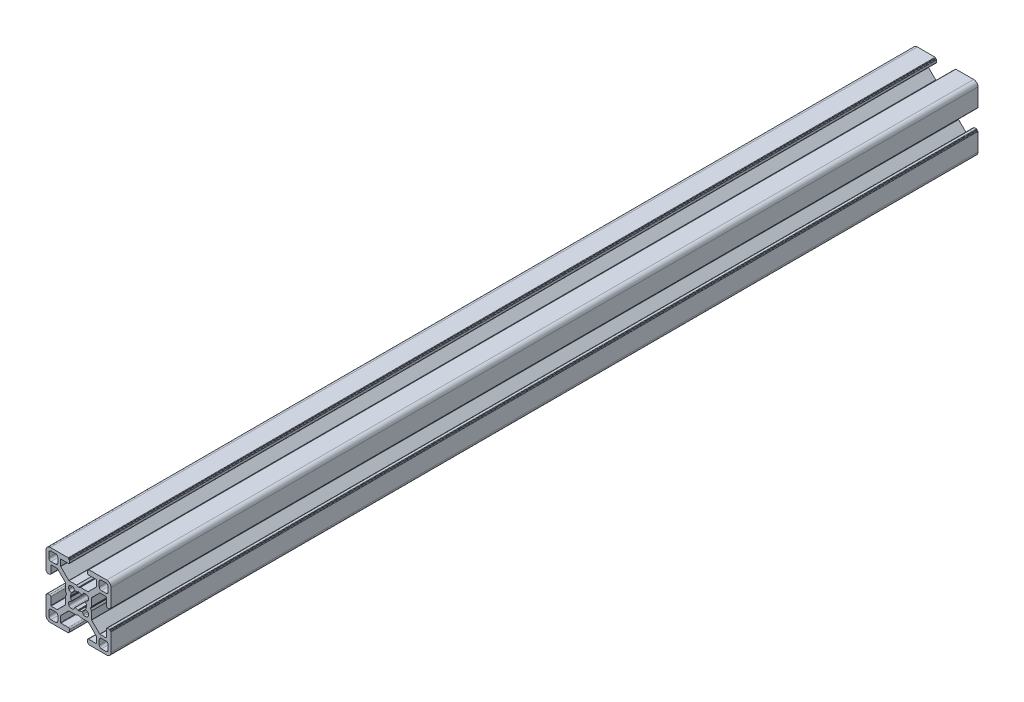
from build123d import *

# Parameters (mm, degrees)
BOSS_EXTRUDE1_DEPTH = 200


with BuildPart() as part:
    # Sketch1 → Boss-Extrude1 (new, symmetric)
    with BuildSketch(Plane.XY):
        with BuildLine():
            Line((15, -4.7974), (15, -12.9934))
            ThreePointArc((15, -12.9934), (14.412280467, -14.412280467), (12.9934, -15))
            Line((12.9934, -15), (4.7974, -15))
            ThreePointArc((4.7974, -15), (4.655978644, -14.941421356), (4.5974, -14.8))
            Line((4.5974, -14.8), (4.5974, -14.7018))
            ThreePointArc((4.5974, -14.7018), (4.538821356, -14.560378644), (4.3974, -14.5018))
            Line((4.3974, -14.5018), (4.2513, -14.5018))
            ThreePointArc((4.2513, -14.5018), (4.109878644, -14.443221356), (4.0513, -14.3018))
            Line((4.0513, -14.3018), (4.0513, -13.4096))
            ThreePointArc((4.0513, -13.4096), (4.229847706, -12.978547706), (4.6609, -12.8))
            Line((4.6609, -12.8), (8.055, -12.8))
            ThreePointArc((8.055, -12.8), (8.196421356, -12.741421356), (8.255, -12.6))
            Line((8.255, -12.6), (8.255, -9.893477631))
            ThreePointArc((8.255, -9.893477631), (8.239775906, -9.816940945), (8.196421356, -9.752056275))
            Line((8.196421356, -9.752056275), (4.510043725, -6.065678644))
            ThreePointArc((4.510043725, -6.065678644), (4.445159055, -6.022324094), (4.368622369, -6.0071))
            Line((4.368622369, -6.0071), (0.933471649, -6.0071))
            ThreePointArc((0.933471649, -6.0071), (0.88170784, -6.000285165), (0.833471649, -5.980305081))
            Line((0.833471649, -5.980305081), (0.1, -5.556835027))
            ThreePointArc((0.1, -5.556835027), (0, -5.530040108), (-0.1, -5.556835027))
            Line((-0.1, -5.556835027), (-0.833471649, -5.980305081))
            ThreePointArc((-0.833471649, -5.980305081), (-0.88170784, -6.000285165), (-0.933471649, -6.0071))
            Line((-0.933471649, -6.0071), (-4.368622369, -6.0071))
            ThreePointArc((-4.368622369, -6.0071), (-4.445159055, -6.022324094), (-4.510043725, -6.065678644))
            Line((-4.510043725, -6.065678644), (-8.196421356, -9.752056275))
            ThreePointArc((-8.196421356, -9.752056275), (-8.239775907, -9.816940945), (-8.255, -9.893477631))
            Line((-8.255, -9.893477631), (-8.255, -12.6))
            ThreePointArc((-8.255, -12.6), (-8.196421356, -12.741421356), (-8.055, -12.8))
            Line((-8.055, -12.8), (-4.6609, -12.8))
            ThreePointArc((-4.6609, -12.8), (-4.229847706, -12.978547706), (-4.0513, -13.4096))
            Line((-4.0513, -13.4096), (-4.0513, -14.3018))
            ThreePointArc((-4.0513, -14.3018), (-4.109878644, -14.443221356), (-4.2513, -14.5018))
            Line((-4.2513, -14.5018), (-4.3974, -14.5018))
            ThreePointArc((-4.3974, -14.5018), (-4.538821356, -14.560378644), (-4.5974, -14.7018))
            Line((-4.5974, -14.7018), (-4.5974, -14.8))
            ThreePointArc((-4.5974, -14.8), (-4.655978644, -14.941421356), (-4.7974, -15))
            Line((-4.7974, -15), (-12.9934, -15))
            ThreePointArc((-12.9934, -15), (-14.412280467, -14.412280467), (-15, -12.9934))
            Line((-15, -12.9934), (-15, -4.7974))
            ThreePointArc((-15, -4.7974), (-14.941421356, -4.655978644), (-14.8, -4.5974))
            Line((-14.8, -4.5974), (-14.7018, -4.5974))
            ThreePointArc((-14.7018, -4.5974), (-14.560378644, -4.538821356), (-14.5018, -4.3974))
            Line((-14.5018, -4.3974), (-14.5018, -4.2513))
            ThreePointArc((-14.5018, -4.2513), (-14.443221356, -4.109878644), (-14.3018, -4.0513))
            Line((-14.3018, -4.0513), (-13.4096, -4.0513))
            ThreePointArc((-13.4096, -4.0513), (-12.978547706, -4.229847706), (-12.8, -4.6609))
            Line((-12.8, -4.6609), (-12.8, -8.055))
            ThreePointArc((-12.8, -8.055), (-12.741421356, -8.196421356), (-12.6, -8.255))
            Line((-12.6, -8.255), (-9.893477631, -8.255))
            ThreePointArc((-9.893477631, -8.255), (-9.816940945, -8.239775907), (-9.752056275, -8.196421356))
            Line((-9.752056275, -8.196421356), (-6.065678644, -4.510043725))
            ThreePointArc((-6.065678644, -4.510043725), (-6.022324093, -4.445159055), (-6.0071, -4.368622369))
            Line((-6.0071, -4.368622369), (-6.0071, -0.933471649))
            ThreePointArc((-6.0071, -0.933471649), (-6.000285165, -0.88170784), (-5.980305081, -0.833471649))
            Line((-5.980305081, -0.833471649), (-5.556835027, -0.1))
            ThreePointArc((-5.556835027, -0.1), (-5.530040108, 0), (-5.556835027, 0.1))
            Line((-5.556835027, 0.1), (-5.980305081, 0.833471649))
            ThreePointArc((-5.980305081, 0.833471649), (-6.000285165, 0.88170784), (-6.0071, 0.933471649))
            Line((-6.0071, 0.933471649), (-6.0071, 4.368622369))
            ThreePointArc((-6.0071, 4.368622369), (-6.022324094, 4.445159055), (-6.065678644, 4.510043725))
            Line((-6.065678644, 4.510043725), (-9.752056275, 8.196421356))
            ThreePointArc((-9.752056275, 8.196421356), (-9.816940945, 8.239775907), (-9.893477631, 8.255))
            Line((-9.893477631, 8.255), (-12.6, 8.255))
            ThreePointArc((-12.6, 8.255), (-12.741421356, 8.196421356), (-12.8, 8.055))
            Line((-12.8, 8.055), (-12.8, 4.6609))
            ThreePointArc((-12.8, 4.6609), (-12.978547706, 4.229847706), (-13.4096, 4.0513))
            Line((-13.4096, 4.0513), (-14.3018, 4.0513))
            ThreePointArc((-14.3018, 4.0513), (-14.443221356, 4.109878644), (-14.5018, 4.2513))
            Line((-14.5018, 4.2513), (-14.5018, 4.3974))
            ThreePointArc((-14.5018, 4.3974), (-14.560378644, 4.538821356), (-14.7018, 4.5974))
            Line((-14.7018, 4.5974), (-14.8, 4.5974))
            ThreePointArc((-14.8, 4.5974), (-14.941421356, 4.655978644), (-15, 4.7974))
            Line((-15, 4.7974), (-15, 12.9934))
            ThreePointArc((-15, 12.9934), (-14.412280467, 14.412280467), (-12.9934, 15))
            Line((-12.9934, 15), (-4.7974, 15))
            ThreePointArc((-4.7974, 15), (-4.655978644, 14.941421356), (-4.5974, 14.8))
            Line((-4.5974, 14.8), (-4.5974, 14.7018))
            ThreePointArc((-4.5974, 14.7018), (-4.538821356, 14.560378644), (-4.3974, 14.5018))
            Line((-4.3974, 14.5018), (-4.2513, 14.5018))
            ThreePointArc((-4.2513, 14.5018), (-4.109878644, 14.443221356), (-4.0513, 14.3018))
            Line((-4.0513, 14.3018), (-4.0513, 13.4096))
            ThreePointArc((-4.0513, 13.4096), (-4.229847706, 12.978547706), (-4.6609, 12.8))
            Line((-4.6609, 12.8), (-8.055, 12.8))
            ThreePointArc((-8.055, 12.8), (-8.196421356, 12.741421356), (-8.255, 12.6))
            Line((-8.255, 12.6), (-8.255, 9.893477631))
            ThreePointArc((-8.255, 9.893477631), (-8.239775907, 9.816940945), (-8.196421356, 9.752056275))
            Line((-8.196421356, 9.752056275), (-4.510043725, 6.065678644))
            ThreePointArc((-4.510043725, 6.065678644), (-4.445159055, 6.022324094), (-4.368622369, 6.0071))
            Line((-4.368622369, 6.0071), (-0.933471649, 6.0071))
            ThreePointArc((-0.933471649, 6.0071), (-0.88170784, 6.000285165), (-0.833471649, 5.980305081))
            Line((-0.833471649, 5.980305081), (-0.1, 5.556835027))
            ThreePointArc((-0.1, 5.556835027), (0, 5.530040108), (0.1, 5.556835027))
            Line((0.1, 5.556835027), (0.833471649, 5.980305081))
            ThreePointArc((0.833471649, 5.980305081), (0.88170784, 6.000285165), (0.933471649, 6.0071))
            Line((0.933471649, 6.0071), (4.368622369, 6.0071))
            ThreePointArc((4.368622369, 6.0071), (4.445159055, 6.022324093), (4.510043725, 6.065678644))
            Line((4.510043725, 6.065678644), (8.196421356, 9.752056275))
            ThreePointArc((8.196421356, 9.752056275), (8.239775906, 9.816940945), (8.255, 9.893477631))
            Line((8.255, 9.893477631), (8.255, 12.6))
            ThreePointArc((8.255, 12.6), (8.196421356, 12.741421356), (8.055, 12.8))
            Line((8.055, 12.8), (4.6609, 12.8))
            ThreePointArc((4.6609, 12.8), (4.229847706, 12.978547706), (4.0513, 13.4096))
            Line((4.0513, 13.4096), (4.0513, 14.3018))
            ThreePointArc((4.0513, 14.3018), (4.109878644, 14.443221356), (4.2513, 14.5018))
            Line((4.2513, 14.5018), (4.3974, 14.5018))
            ThreePointArc((4.3974, 14.5018), (4.538821356, 14.560378644), (4.5974, 14.7018))
            Line((4.5974, 14.7018), (4.5974, 14.8))
            ThreePointArc((4.5974, 14.8), (4.655978644, 14.941421356), (4.7974, 15))
            Line((4.7974, 15), (12.9934, 15))
            ThreePointArc((12.9934, 15), (14.412280467, 14.412280467), (15, 12.9934))
            Line((15, 12.9934), (15, 4.7974))
            ThreePointArc((15, 4.7974), (14.941421356, 4.655978644), (14.8, 4.5974))
            Line((14.8, 4.5974), (14.7018, 4.5974))
            ThreePointArc((14.7018, 4.5974), (14.560378644, 4.538821356), (14.5018, 4.3974))
            Line((14.5018, 4.3974), (14.5018, 4.2513))
            ThreePointArc((14.5018, 4.2513), (14.443221356, 4.109878644), (14.3018, 4.0513))
            Line((14.3018, 4.0513), (13.4096, 4.0513))
            ThreePointArc((13.4096, 4.0513), (12.978547706, 4.229847706), (12.8, 4.6609))
            Line((12.8, 4.6609), (12.8, 8.055))
            ThreePointArc((12.8, 8.055), (12.741421356, 8.196421356), (12.6, 8.255))
            Line((12.6, 8.255), (9.893477631, 8.255))
            ThreePointArc((9.893477631, 8.255), (9.816940945, 8.239775907), (9.752056275, 8.196421356))
            Line((9.752056275, 8.196421356), (6.065678644, 4.510043725))
            ThreePointArc((6.065678644, 4.510043725), (6.022324094, 4.445159055), (6.0071, 4.368622369))
            Line((6.0071, 4.368622369), (6.0071, 0.933471649))
            ThreePointArc((6.0071, 0.933471649), (6.000285165, 0.88170784), (5.980305081, 0.833471649))
            Line((5.980305081, 0.833471649), (5.556835027, 0.1))
            ThreePointArc((5.556835027, 0.1), (5.530040108, 0), (5.556835027, -0.1))
            Line((5.556835027, -0.1), (5.980305081, -0.833471649))
            ThreePointArc((5.980305081, -0.833471649), (6.000285165, -0.88170784), (6.0071, -0.933471649))
            Line((6.0071, -0.933471649), (6.0071, -4.368622369))
            ThreePointArc((6.0071, -4.368622369), (6.022324094, -4.445159055), (6.065678644, -4.510043725))
            Line((6.065678644, -4.510043725), (9.752056275, -8.196421356))
            ThreePointArc((9.752056275, -8.196421356), (9.816940945, -8.239775907), (9.893477631, -8.255))
            Line((9.893477631, -8.255), (12.6, -8.255))
            ThreePointArc((12.6, -8.255), (12.741421356, -8.196421356), (12.8, -8.055))
            Line((12.8, -8.055), (12.8, -4.6609))
            ThreePointArc((12.8, -4.6609), (12.978547706, -4.229847706), (13.4096, -4.0513))
            Line((13.4096, -4.0513), (14.3018, -4.0513))
            ThreePointArc((14.3018, -4.0513), (14.443221356, -4.109878644), (14.5018, -4.2513))
            Line((14.5018, -4.2513), (14.5018, -4.3974))
            ThreePointArc((14.5018, -4.3974), (14.560378644, -4.538821356), (14.7018, -4.5974))
            Line((14.7018, -4.5974), (14.8, -4.5974))
            ThreePointArc((14.8, -4.5974), (14.941421356, -4.655978644), (15, -4.7974))
        make_face()
        with BuildLine():
            Line((10.555, -9.555), (12.7, -9.555))
            ThreePointArc((12.7, -9.555), (13.407106781, -9.847893219), (13.7, -10.555))
            Line((13.7, -10.555), (13.7, -12.7))
            ThreePointArc((13.7, -12.7), (13.407106781, -13.407106781), (12.7, -13.7))
            Line((12.7, -13.7), (10.555, -13.7))
            ThreePointArc((10.555, -13.7), (9.847893219, -13.407106781), (9.555, -12.7))
            Line((9.555, -12.7), (9.555, -10.555))
            ThreePointArc((9.555, -10.555), (9.847893219, -9.847893219), (10.555, -9.555))
        make_face(mode=Mode.SUBTRACT)
        with BuildLine():
            Line((-2.649655202, 4.5071), (-3.5071, 4.5071))
            ThreePointArc((-3.5071, 4.5071), (-4.214206781, 4.214206781), (-4.5071, 3.5071))
            Line((-4.5071, 3.5071), (-4.5071, 2.649655202))
            ThreePointArc((-4.5071, 2.649655202), (-4.434555935, 2.390268573), (-4.237974307, 2.206149785))
            Line((-4.237974307, 2.206149785), (-3.405850867, 1.77297374))
            ThreePointArc((-3.405850867, 1.77297374), (-3.309086477, 1.660655001), (-3.316234838, 1.512574795))
            ThreePointArc((-3.316234838, 1.512574795), (-3.518688583, 0.950855754), (-3.626717027, 0.363620149))
            ThreePointArc((-3.626717027, 0.363620149), (-3.635360462, 0.322224961), (-3.652514225, 0.283572419))
            Line((-3.652514225, 0.283572419), (-3.758499811, 0.1))
            ThreePointArc((-3.758499811, 0.1), (-3.78529473, 0), (-3.758499811, -0.1))
            Line((-3.758499811, -0.1), (-3.652514225, -0.283572419))
            ThreePointArc((-3.652514225, -0.283572419), (-3.635360462, -0.322224961), (-3.626717027, -0.363620149))
            ThreePointArc((-3.626717027, -0.363620149), (-3.518688583, -0.950855754), (-3.316234838, -1.512574795))
            ThreePointArc((-3.316234838, -1.512574795), (-3.309086477, -1.660655001), (-3.405850867, -1.77297374))
            Line((-3.405850867, -1.77297374), (-4.237974307, -2.206149785))
            ThreePointArc((-4.237974307, -2.206149785), (-4.434555935, -2.390268573), (-4.5071, -2.649655202))
            Line((-4.5071, -2.649655202), (-4.5071, -3.5071))
            ThreePointArc((-4.5071, -3.5071), (-4.214206781, -4.214206781), (-3.5071, -4.5071))
            Line((-3.5071, -4.5071), (-2.649655202, -4.5071))
            ThreePointArc((-2.649655202, -4.5071), (-2.390268573, -4.434555935), (-2.206149785, -4.237974307))
            Line((-2.206149785, -4.237974307), (-1.77297374, -3.405850867))
            ThreePointArc((-1.77297374, -3.405850867), (-1.660655001, -3.309086477), (-1.512574795, -3.316234838))
            ThreePointArc((-1.512574795, -3.316234838), (-0.950855754, -3.518688583), (-0.363620149, -3.626717027))
            ThreePointArc((-0.363620149, -3.626717027), (-0.322224961, -3.635360462), (-0.283572419, -3.652514225))
            Line((-0.283572419, -3.652514225), (-0.1, -3.758499811))
            ThreePointArc((-0.1, -3.758499811), (0, -3.78529473), (0.1, -3.758499811))
            Line((0.1, -3.758499811), (0.283572419, -3.652514225))
            ThreePointArc((0.283572419, -3.652514225), (0.322224961, -3.635360462), (0.363620149, -3.626717027))
            ThreePointArc((0.363620149, -3.626717027), (0.950855754, -3.518688583), (1.512574795, -3.316234838))
            ThreePointArc((1.512574795, -3.316234838), (1.660655001, -3.309086477), (1.77297374, -3.405850867))
            Line((1.77297374, -3.405850867), (2.206149785, -4.237974307))
            ThreePointArc((2.206149785, -4.237974307), (2.390268573, -4.434555935), (2.649655202, -4.5071))
            Line((2.649655202, -4.5071), (3.5071, -4.5071))
            ThreePointArc((3.5071, -4.5071), (4.214206781, -4.214206781), (4.5071, -3.5071))
            Line((4.5071, -3.5071), (4.5071, -2.649655202))
            ThreePointArc((4.5071, -2.649655202), (4.434555935, -2.390268573), (4.237974307, -2.206149785))
            Line((4.237974307, -2.206149785), (3.405850867, -1.77297374))
            ThreePointArc((3.405850867, -1.77297374), (3.309086477, -1.660655001), (3.316234838, -1.512574795))
            ThreePointArc((3.316234838, -1.512574795), (3.518688583, -0.950855754), (3.626717027, -0.363620149))
            ThreePointArc((3.626717027, -0.363620149), (3.635360462, -0.322224961), (3.652514225, -0.283572419))
            Line((3.652514225, -0.283572419), (3.758499811, -0.1))
            ThreePointArc((3.758499811, -0.1), (3.78529473, 0), (3.758499811, 0.1))
            Line((3.758499811, 0.1), (3.652514225, 0.283572419))
            ThreePointArc((3.652514225, 0.283572419), (3.635360462, 0.322224961), (3.626717027, 0.363620149))
            ThreePointArc((3.626717027, 0.363620149), (3.518688583, 0.950855754), (3.316234838, 1.512574795))
            ThreePointArc((3.316234838, 1.512574795), (3.309086477, 1.660655001), (3.405850867, 1.77297374))
            Line((3.405850867, 1.77297374), (4.237974307, 2.206149785))
            ThreePointArc((4.237974307, 2.206149785), (4.434555935, 2.390268573), (4.5071, 2.649655202))
            Line((4.5071, 2.649655202), (4.5071, 3.5071))
            ThreePointArc((4.5071, 3.5071), (4.214206781, 4.214206781), (3.5071, 4.5071))
            Line((3.5071, 4.5071), (2.649655202, 4.5071))
            ThreePointArc((2.649655202, 4.5071), (2.390268573, 4.434555935), (2.206149785, 4.237974307))
            Line((2.206149785, 4.237974307), (1.77297374, 3.405850867))
            ThreePointArc((1.77297374, 3.405850867), (1.660655001, 3.309086477), (1.512574795, 3.316234838))
            ThreePointArc((1.512574795, 3.316234838), (0.950855754, 3.518688583), (0.363620149, 3.626717027))
            ThreePointArc((0.363620149, 3.626717027), (0.322224961, 3.635360462), (0.283572419, 3.652514225))
            Line((0.283572419, 3.652514225), (0.1, 3.758499811))
            ThreePointArc((0.1, 3.758499811), (0, 3.78529473), (-0.1, 3.758499811))
            Line((-0.1, 3.758499811), (-0.283572419, 3.652514225))
            ThreePointArc((-0.283572419, 3.652514225), (-0.322224961, 3.635360462), (-0.363620149, 3.626717027))
            ThreePointArc((-0.363620149, 3.626717027), (-0.950855754, 3.518688583), (-1.512574795, 3.316234838))
            ThreePointArc((-1.512574795, 3.316234838), (-1.660655001, 3.309086477), (-1.77297374, 3.405850867))
            Line((-1.77297374, 3.405850867), (-2.206149785, 4.237974307))
            ThreePointArc((-2.206149785, 4.237974307), (-2.390268573, 4.434555935), (-2.649655202, 4.5071))
        make_face(mode=Mode.SUBTRACT)
        with BuildLine():
            Line((-13.7, -10.555), (-13.7, -12.7))
            ThreePointArc((-13.7, -12.7), (-13.407106781, -13.407106781), (-12.7, -13.7))
            Line((-12.7, -13.7), (-10.555, -13.7))
            ThreePointArc((-10.555, -13.7), (-9.847893219, -13.407106781), (-9.555, -12.7))
            Line((-9.555, -12.7), (-9.555, -10.555))
            ThreePointArc((-9.555, -10.555), (-9.847893219, -9.847893219), (-10.555, -9.555))
            Line((-10.555, -9.555), (-12.7, -9.555))
            ThreePointArc((-12.7, -9.555), (-13.407106781, -9.847893219), (-13.7, -10.555))
        make_face(mode=Mode.SUBTRACT)
        with BuildLine():
            Line((-10.555, 9.555), (-12.7, 9.555))
            ThreePointArc((-12.7, 9.555), (-13.407106781, 9.847893219), (-13.7, 10.555))
            Line((-13.7, 10.555), (-13.7, 12.7))
            ThreePointArc((-13.7, 12.7), (-13.407106781, 13.407106781), (-12.7, 13.7))
            Line((-12.7, 13.7), (-10.555, 13.7))
            ThreePointArc((-10.555, 13.7), (-9.847893219, 13.407106781), (-9.555, 12.7))
            Line((-9.555, 12.7), (-9.555, 10.555))
            ThreePointArc((-9.555, 10.555), (-9.847893219, 9.847893219), (-10.555, 9.555))
        make_face(mode=Mode.SUBTRACT)
        with BuildLine():
            Line((13.7, 10.555), (13.7, 12.7))
            ThreePointArc((13.7, 12.7), (13.407106781, 13.407106781), (12.7, 13.7))
            Line((12.7, 13.7), (10.555, 13.7))
            ThreePointArc((10.555, 13.7), (9.847893219, 13.407106781), (9.555, 12.7))
            Line((9.555, 12.7), (9.555, 10.555))
            ThreePointArc((9.555, 10.555), (9.847893219, 9.847893219), (10.555, 9.555))
            Line((10.555, 9.555), (12.7, 9.555))
            ThreePointArc((12.7, 9.555), (13.407106781, 9.847893219), (13.7, 10.555))
        make_face(mode=Mode.SUBTRACT)
    extrude(amount=BOSS_EXTRUDE1_DEPTH, both=True)


solid = part.part
